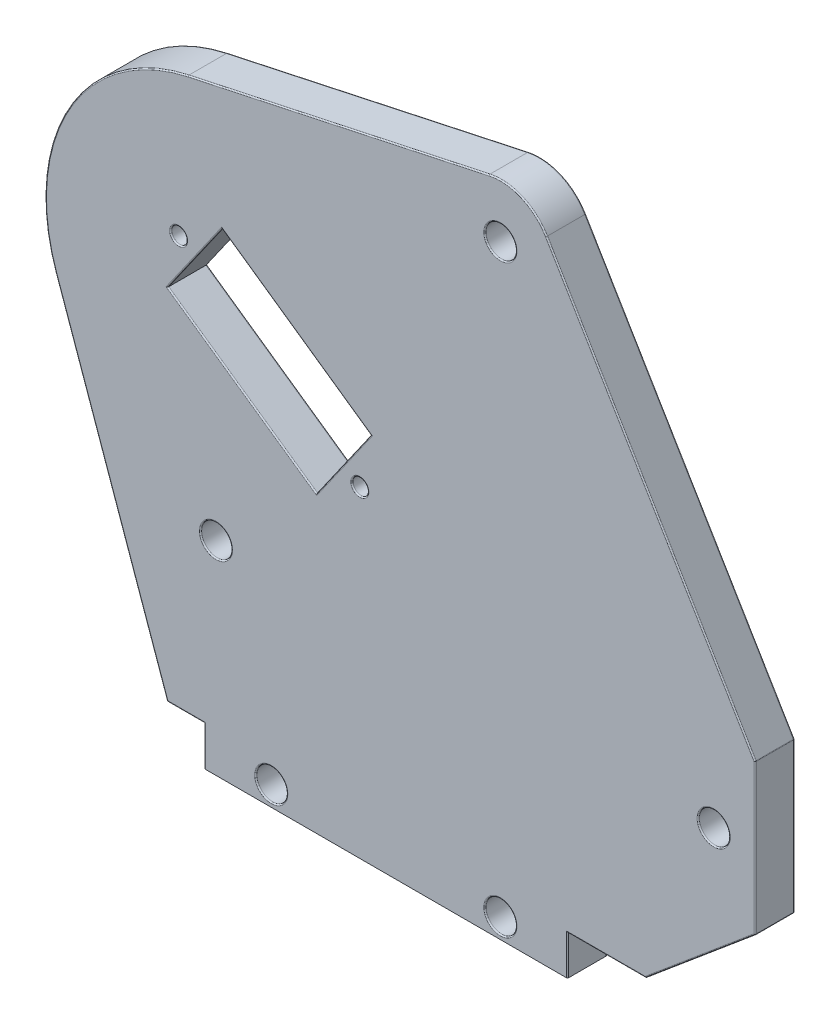
from build123d import *

# Parameters (mm, degrees)
SKETCH1_R              = 1
BOSS_EXTRUDE1_DEPTH    = 5
M3_5_CLEARANCE_HOLE1_D = 3.9
FILLET1_R              = 0.15
SKETCH6_W              = 46
SKETCH6_H              = 5
CUT_EXTRUDE1_DEPTH     = 101.026575199


with BuildPart() as part:
    # Sketch1 → Boss-Extrude1 (new body)
    with BuildSketch(Plane.XY):
        with BuildLine():
            Line((-23, 0), (-23, 10))
            Line((-23, 10), (-27.677637192, 10))
            Line((-27.677637192, 10), (-41.789657152, 49.963208331))
            ThreePointArc((-41.789657152, 49.963208331), (-40.186834427, 68.742040492), (-25.029728066, 79.943634341))
            Line((-25.029728066, 79.943634341), (13.072325527, 88.138211024))
            ThreePointArc((13.072325527, 88.138211024), (17.212308537, 87.724747577), (20.333918421, 84.974117998))
            Line((20.333918421, 84.974117998), (46.74603348, 40.621529892))
            Line((46.74603348, 40.621529892), (46.74603348, 21.621529892))
            Line((46.74603348, 21.621529892), (32.89603348, 10))
            Line((32.89603348, 10), (23, 10))
            Line((23, 10), (23, 0))
            Line((23, 0), (-23, 0))
        make_face()
        with Locations((-26.225526871, 61.785115186)):
            Circle(SKETCH1_R, mode=Mode.SUBTRACT)
        with Locations(Location((-3.289269631, 45.724974968, 0), (0, 0, 180))):
            Circle(SKETCH1_R, mode=Mode.SUBTRACT)
        Polygon((-27.619105379, 55.43626183), (-20.736188142, 65.266086361), (-1.895691124, 52.073828325), (-8.77860836, 42.244003794), align=None, mode=Mode.SUBTRACT)
    extrude(amount=BOSS_EXTRUDE1_DEPTH)

    # M3.5 Clearance Hole1 (through all)
    with Locations(Plane.XY.offset(5)):
        with Locations((14.5, 81.5), (41.49603348, 30.751867008), (14.5, 7.5), (-14.5, 7.5), (-21.5, 30.751867008)):
            Hole(M3_5_CLEARANCE_HOLE1_D / 2)

    # Fillet1
    fillet1_edges = [part.edges().sort_by_distance(p)[0] for p in [
        (-23, 5, 0),
        (-25.338818596, 10, 0),
        (27.94801674, 10, 5),
        (-34.733647172, 29.981604166, 0),
        (-40.186834427, 68.742040492, 0),
        (-5.978701269, 84.040922682, 0),
        (17.212308537, 87.724747577, 0),
        (33.53997595, 62.797823945, 0),
        (46.74603348, 31.121529892, 0),
        (39.82103348, 15.810764946, 0),
        (27.94801674, 10, 0),
        (23, 5, 0),
        (0, 0, 0),
        (39.82103348, 15.810764946, 5),
        (-23, 0, 2.5),
        (-27.677637192, 10, 2.5),
        (46.74603348, 31.121529892, 5),
        (46.74603348, 40.621529892, 2.5),
        (46.74603348, 21.621529892, 2.5),
        (32.89603348, 10, 2.5),
        (23, 0, 2.5),
        (33.53997595, 62.797823945, 5),
        (17.212308537, 87.724747577, 5),
        (-5.978701269, 84.040922682, 5),
        (-18.198856869, 48.840132812, 0),
        (-5.337149742, 47.158916059, 0),
        (-11.315939633, 58.669957343, 0),
        (-24.177646761, 60.351174095, 0),
        (-18.198856869, 48.840132812, 5),
        (-5.337149742, 47.158916059, 5),
        (-11.315939633, 58.669957343, 5),
        (-24.177646761, 60.351174095, 5),
        (-40.186834427, 68.742040492, 5),
        (-34.733647172, 29.981604166, 5),
        (-27.225526871, 61.785115186, 0),
        (-27.225526871, 61.785115186, 5),
        (-25.338818596, 10, 5),
        (-2.289269631, 45.724974968, 0),
        (-2.289269631, 45.724974968, 5),
        (-23, 5, 5),
        (0, 0, 5),
        (-19.55, 30.751867008, 5),
        (-19.55, 30.751867008, 0),
        (-12.55, 7.5, 5),
        (-12.55, 7.5, 0),
        (16.45, 7.5, 5),
        (16.45, 7.5, 0),
        (43.44603348, 30.751867008, 5),
        (43.44603348, 30.751867008, 0),
        (16.45, 81.5, 5),
        (16.45, 81.5, 0),
        (23, 5, 5),
    ]]
    fillet(fillet1_edges, radius=FILLET1_R)

    # Sketch6 → Cut-Extrude1 (cut, through all)
    with BuildSketch(Plane.XY):
        with Locations((0, 2.5)):
            Rectangle(SKETCH6_W, SKETCH6_H)
    extrude(amount=CUT_EXTRUDE1_DEPTH, mode=Mode.SUBTRACT)


solid = part.part
